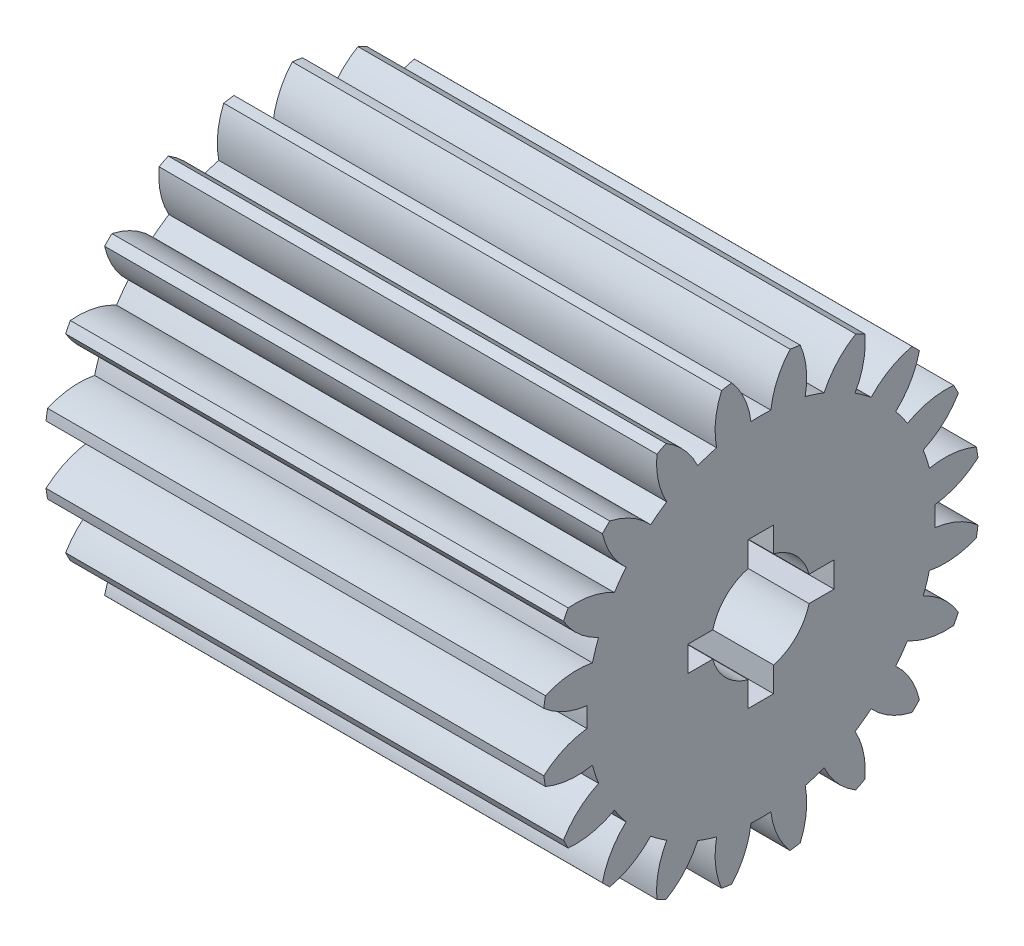
from build123d import *

# Parameters (mm, degrees)
BASPROSKE_W        = 10
BASPROSKE_H        = 4.4
TOOTHCUT_DEPTH     = 12.777945491
TEETHCUTS_COUNT    = 20
TEETHCUTS_ANGLE    = 342
BORSKE_R           = 1
BORE_DEPTH         = 50.0000508
SKETCH1_W          = 0.51
SKETCH1_H          = 0.51
CUT_EXTRUDE1_DEPTH = 100


with BuildPart() as part:
    # BasProSke → Base-Revolve (revolve)
    with BuildSketch(Plane(origin=(0, 0, 0), x_dir=(1, 0, 0), z_dir=(0, 1, 0)), mode=Mode.PRIVATE) as base_revolve_sk:
        with Locations((5, 2.2)):
            Rectangle(BASPROSKE_W, BASPROSKE_H)
    revolve(base_revolve_sk.sketch.rotate(Axis((-10, 0, 0), (1, 0, 0)), 180), axis=Axis((-10, 0, 0), (1, 0, 0)))

    # TooCutSke → ToothCut (cut, through all)
    with BuildSketch(Plane(origin=(0, 0, 0), x_dir=(0, 0, -1), z_dir=(1, 0, 0))):
        with BuildLine():
            ThreePointArc((0.199592598, 3.493302706), (0, 3.499), (-0.199592598, 3.493302706))
            ThreePointArc((-0.199592598, 3.493302706), (-0.333052166, 3.970347354), (-0.606028648, 4.383707841))
            ThreePointArc((-0.606028648, 4.383707841), (0, 4.4254), (0.606028648, 4.383707841))
            ThreePointArc((0.606028648, 4.383707841), (0.333052166, 3.970347354), (0.199592598, 3.493302706))
        make_face()
    toothcut = extrude(amount=TOOTHCUT_DEPTH, mode=Mode.SUBTRACT)

    # TeethCuts: ToothCut ×20 about axis
    teethcuts_axis = Axis((-10, 0, 0), (1, 0, 0))
    for i in range(1, TEETHCUTS_COUNT):
        add(toothcut.rotate(teethcuts_axis, i * TEETHCUTS_ANGLE / (TEETHCUTS_COUNT - 1)), mode=Mode.SUBTRACT)

    # BorSke → Bore (cut, symmetric)
    with BuildSketch(Plane(origin=(0, 0, 0), x_dir=(0, 0, -1), z_dir=(1, 0, 0))):
        with Locations(Location((0, 0, 0), (0, 0, 180))):
            Circle(BORSKE_R)
    extrude(amount=BORE_DEPTH, both=True, mode=Mode.SUBTRACT)

    # Sketch1 → Cut-Extrude1 (cut)
    with BuildSketch(Plane(origin=(10, 0, 0), x_dir=(0, 0, -1), z_dir=(1, 0, 0))):
        with Locations((0, 1.213665218)):
            Rectangle(SKETCH1_W, SKETCH1_H)
        with Locations((1.213665218, 0)):
            Rectangle(SKETCH1_W, SKETCH1_H)
        with Locations((0, -1.213665218)):
            Rectangle(SKETCH1_W, SKETCH1_H)
        with Locations((-1.213665218, 0)):
            Rectangle(SKETCH1_W, SKETCH1_H)
    extrude(amount=-CUT_EXTRUDE1_DEPTH, mode=Mode.SUBTRACT)


solid = part.part
